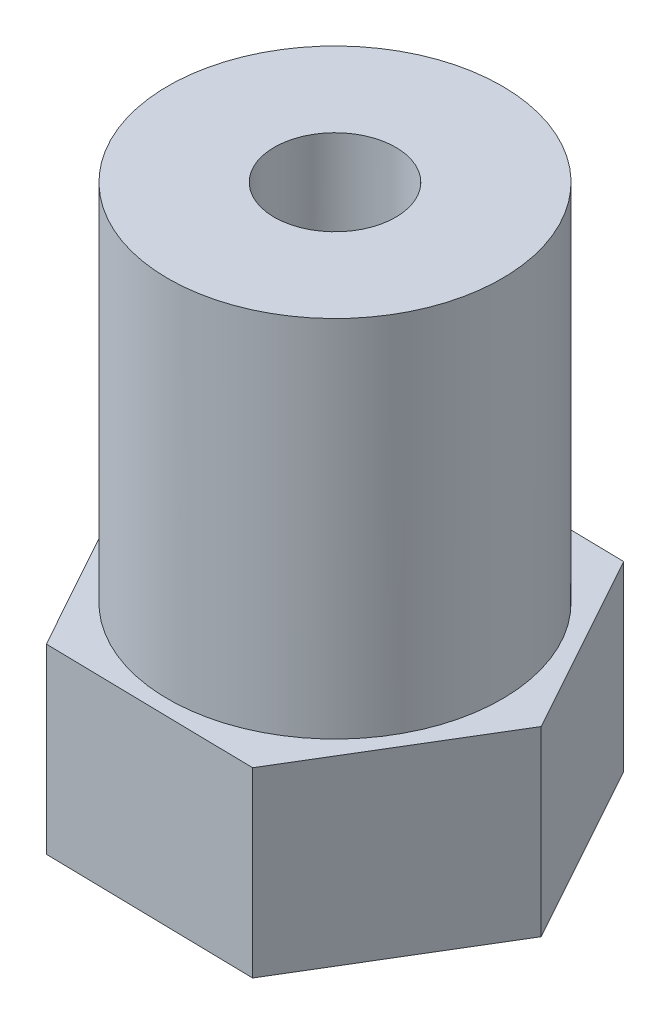
from build123d import *

# Parameters (mm, degrees)
SKETCH_1_R          = 5.5
EXTRUDE_1_DEPTH     = 12
SKETCH_2_R          = 2
CUT_EXTRUDE_1_DEPTH = 12
EXTRUDE_2_DEPTH     = 6
SKETCH_4_R          = 2
CUT_EXTRUDE_2_DEPTH = 21.217986778
SKETCH_5_R          = 2
CUT_EXTRUDE_3_DEPTH = 6


with BuildPart() as part:
    # 草图1 → 凸台-拉伸1 (new body)
    with BuildSketch(Plane(origin=(0, 0, 0), x_dir=(1, 0, 0), z_dir=(0, 1, 0))):
        with Locations(Location((0, 0, 0), (0, 0, 270))):
            Circle(SKETCH_1_R)
    extrude(amount=EXTRUDE_1_DEPTH)

    # 草图2 → 切除-拉伸1 (cut)
    with BuildSketch(Plane(origin=(0, 12, 0), x_dir=(1, 0, 0), z_dir=(0, 1, 0))):
        with Locations(Location((0, 0, 0), (0, 0, 270))):
            Circle(SKETCH_2_R)
    extrude(amount=-CUT_EXTRUDE_1_DEPTH, mode=Mode.SUBTRACT)

    # 草图3 → 凸台-拉伸2 (add)
    with BuildSketch(Plane(origin=(0, 0, 0), x_dir=(-1, 0, 0), z_dir=(0, -1, 0))):
        Polygon((3.577982267, -5.932793852), (6.926941325, 0.132226612), (3.348959058, 6.065020464), (-3.577982267, 5.932793852), (-6.926941325, -0.132226612), (-3.348959058, -6.065020464), align=None)
    extrude(amount=EXTRUDE_2_DEPTH)

    # 草图4 → 切除-拉伸2 (cut, through all)
    with BuildSketch(Plane.XZ.offset(6)):
        with Locations(Location((0, 0, 0), (0, 0, 90))):
            Circle(SKETCH_4_R)
    extrude(amount=-CUT_EXTRUDE_2_DEPTH, mode=Mode.SUBTRACT)

    # 草图5 → 切除-拉伸3 (cut)
    with BuildSketch(Plane(origin=(0.114511605, 0, -5.998907158), x_dir=(-0.9998178596958822, 0, -0.019085267437092362), z_dir=(0.01908526743709236, 0, -0.9998178596958821))):
        with Locations((0, 6)):
            Circle(SKETCH_5_R)
    extrude(amount=-CUT_EXTRUDE_3_DEPTH, mode=Mode.SUBTRACT)


solid = part.part
